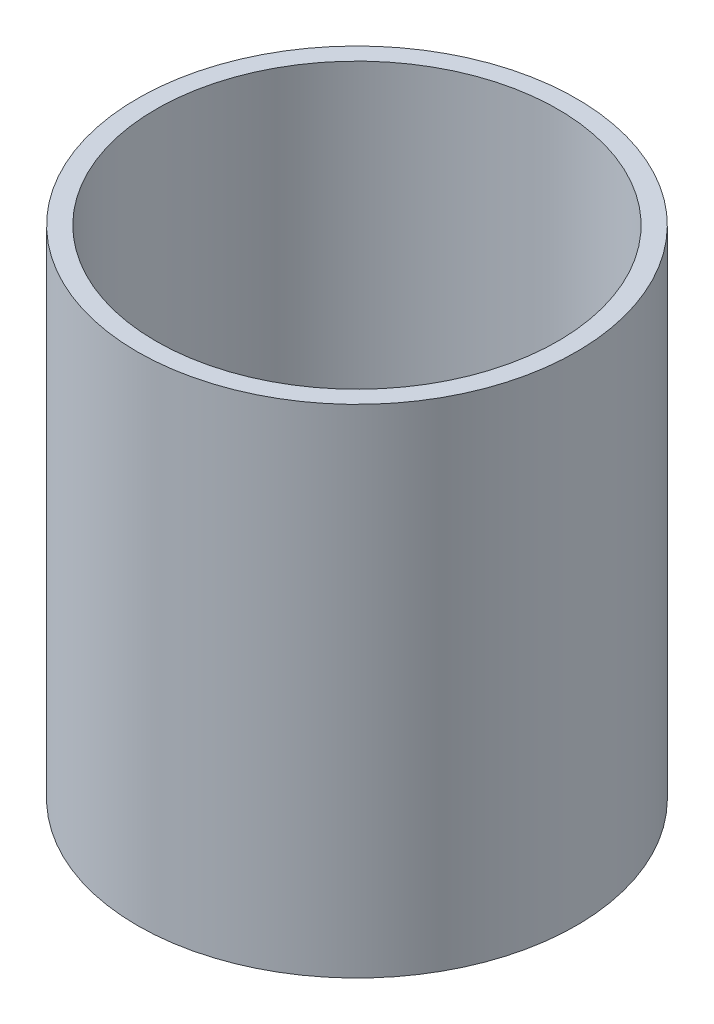
from build123d import *

# Parameters (mm, degrees)
SKETCH1_R           = 84.15
SKETCH1_R_2         = 77.05
BOSS_EXTRUDE1_DEPTH = 190.5


with BuildPart() as part:
    # Sketch1 → Boss-Extrude1 (new body)
    with BuildSketch(Plane(origin=(0, 0, 0), x_dir=(1, 0, 0), z_dir=(0, 1, 0))):
        with Locations(Location((0, 0, 0), (0, 0, 270))):
            Circle(SKETCH1_R)
        with Locations(Location((0, 0, 0), (0, 0, 270))):
            Circle(SKETCH1_R_2, mode=Mode.SUBTRACT)
    extrude(amount=BOSS_EXTRUDE1_DEPTH)


solid = part.part
